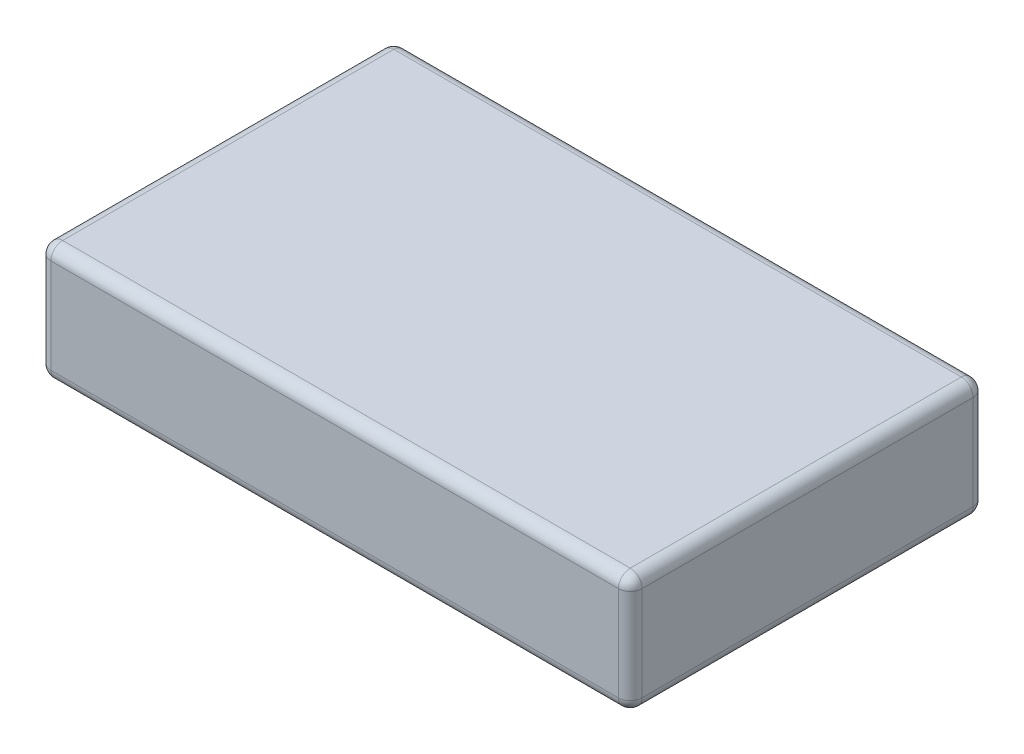
from build123d import *

# Parameters (mm, degrees)
SKETCH1_W           = 50
SKETCH1_H           = 30
BOSS_EXTRUDE1_DEPTH = 10
FILLET1_R           = 1


with BuildPart() as part:
    # Sketch1 → Boss-Extrude1 (new body)
    with BuildSketch(Plane(origin=(0, 0, 0), x_dir=(1, 0, 0), z_dir=(0, 1, 0))):
        Rectangle(SKETCH1_W, SKETCH1_H)
    extrude(amount=BOSS_EXTRUDE1_DEPTH)

    # Fillet1
    fillet1_edges = [part.edges().sort_by_distance(p)[0] for p in [
        (25, 10, 0),
        (0, 10, -15),
        (-25, 10, 0),
        (0, 0, -15),
        (25, 0, 0),
        (0, 0, 15),
        (-25, 0, 0),
        (-25, 5, -15),
        (25, 5, -15),
        (25, 5, 15),
        (-25, 5, 15),
        (0, 10, 15),
    ]]
    fillet(fillet1_edges, radius=FILLET1_R)


solid = part.part
